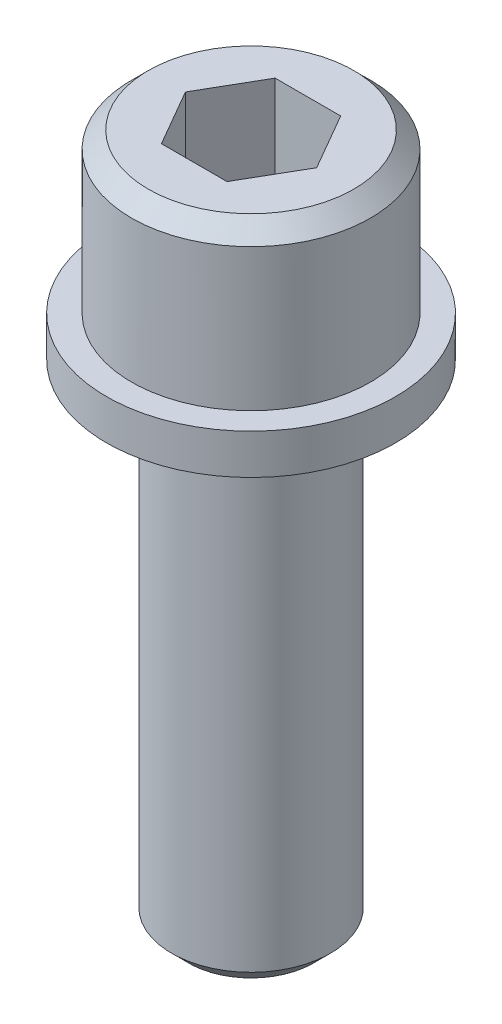
from build123d import *

# Parameters (mm, degrees)
CUT_EXTRUDE1_DEPTH = 6.4
CHAMFER1_SIZE      = 1


with BuildPart() as part:
    # Sketch1 → Revolve1 (revolve)
    with BuildSketch(Plane.XY, mode=Mode.PRIVATE) as revolve1_sk:
        Polygon((0, 0), (0, 41.3), (7.15, 41.3), (7.15, 31.8), (8.65, 31.8), (8.65, 29.4), (4.75, 29.4), (4.75, 0), align=None)
    revolve(revolve1_sk.sketch.rotate(Axis((0, 0, 0), (0, 1, 0)), 90), axis=Axis((0, 0, 0), (0, 1, 0)))

    # Sketch2 → Cut-Extrude1 (cut)
    with BuildSketch(Plane(origin=(0, 41.3, 0), x_dir=(1, 0, 0), z_dir=(0, 1, 0))):
        Polygon((3.92598183, 0), (1.962990915, 3.4), (-1.962990915, 3.4), (-3.92598183, 0), (-1.962990915, -3.4), (1.962990915, -3.4), align=None)
    extrude(amount=-CUT_EXTRUDE1_DEPTH, mode=Mode.SUBTRACT)

    # Chamfer1
    chamfer1_edges = [part.edges().sort_by_distance(p)[0] for p in [
        (0, 0, 4.75),
        (0, 41.3, 7.15),
    ]]
    chamfer(chamfer1_edges, length=CHAMFER1_SIZE)


solid = part.part
